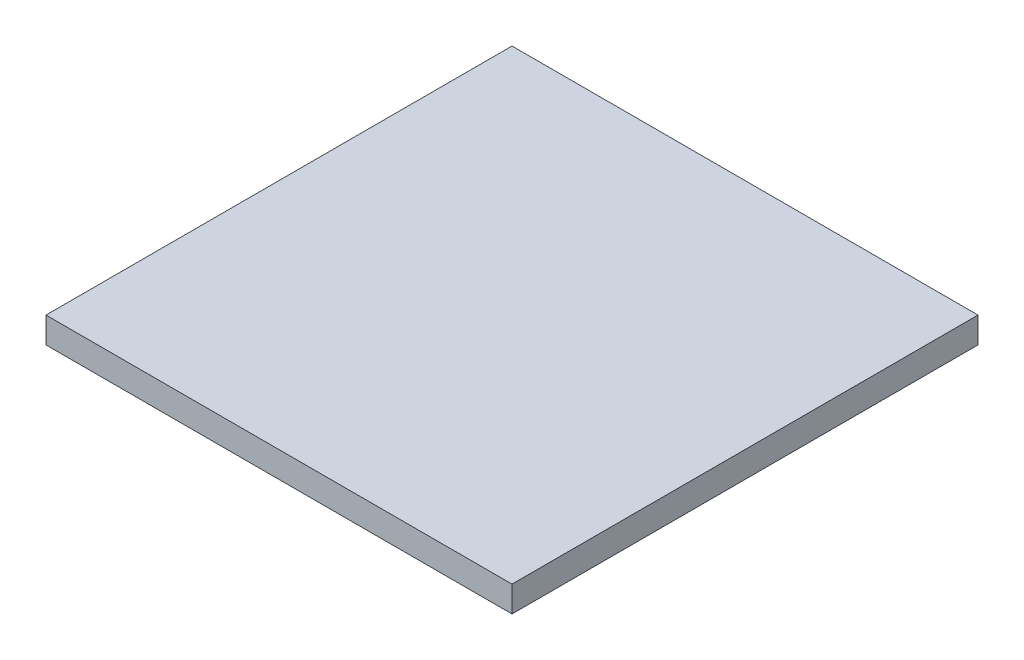
from build123d import *

# Parameters (mm, degrees)
SKETCH1_W           = 180
SKETCH1_H           = 180
BOSS_EXTRUDE1_DEPTH = 10


with BuildPart() as part:
    # Sketch1 → Boss-Extrude1 (new body)
    with BuildSketch(Plane(origin=(0, 0, 0), x_dir=(1, 0, 0), z_dir=(0, 1, 0))):
        with Locations((90, 90)):
            Rectangle(SKETCH1_W, SKETCH1_H)
    extrude(amount=BOSS_EXTRUDE1_DEPTH)


solid = part.part
